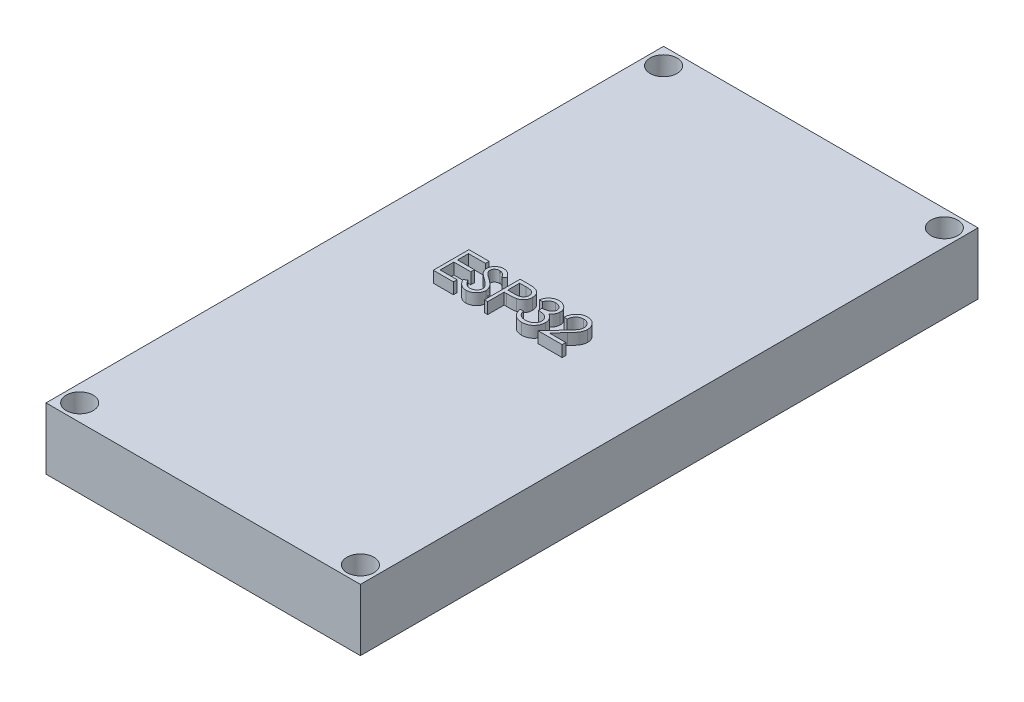
from build123d import *

# Parameters (mm, degrees)
SKETCH1_W           = 28
SKETCH1_H           = 55
SKETCH1_R           = 1.2
BOSS_EXTRUDE1_DEPTH = 5.5
BOSS_EXTRUDE2_DEPTH = 1


with BuildPart() as part:
    # Sketch1 → Boss-Extrude1 (new body)
    with BuildSketch(Plane(origin=(0, 0, 0), x_dir=(1, 0, 0), z_dir=(0, 1, 0))):
        Rectangle(SKETCH1_W, SKETCH1_H)
        with Locations(Location((-12.5, 26, 0), (0, 0, 270))):
            Circle(SKETCH1_R, mode=Mode.SUBTRACT)
        with Locations(Location((-12.5, -26, 0), (0, 0, 270))):
            Circle(SKETCH1_R, mode=Mode.SUBTRACT)
        with Locations(Location((12.5, -26, 0), (0, 0, 270))):
            Circle(SKETCH1_R, mode=Mode.SUBTRACT)
        with Locations(Location((12.5, 26, 0), (0, 0, 270))):
            Circle(SKETCH1_R, mode=Mode.SUBTRACT)
    extrude(amount=BOSS_EXTRUDE1_DEPTH)

    # Sketch2 → Boss-Extrude2 (add)
    # profile 1 of 5: a face of its own
    with BuildSketch(Plane(origin=(0, 5.5, 0), x_dir=(1, 0, 0), z_dir=(0, 1, 0))):
        Polygon((-5.984730254, 2.150902406), (-4.193704613, 2.150902406), (-4.193704613, 1.82526138), (-5.699794357, 1.82526138), (-5.699794357, 0.848338303), (-4.193704613, 0.848338303), (-4.193704613, 0.522697278), (-5.699794357, 0.522697278), (-5.699794357, -0.698456569), (-4.193704613, -0.698456569), (-4.193704613, -1.024097594), (-5.984730254, -1.024097594), align=None)
    # profile 2 of 5: a face of its own
    with BuildSketch(Plane(origin=(0, 5.5, 0), x_dir=(1, 0, 0), z_dir=(0, 1, 0))):
        with BuildLine():
            Line((-3.949473844, -0.411612618), (-3.681074405, -0.250700158))
            add(Edge.make_bspline(
                [(-3.681074405, -0.250700158), (-3.656111433, -0.292487136), (-3.608283341, -0.372549373), (-3.528498894, -0.480733452), (-3.445828324, -0.572683409), (-3.359659429, -0.647864332), (-3.270518176, -0.707054393), (-3.177822642, -0.748966418), (-3.081885199, -0.775106624), (-3.016594661, -0.778281702), (-2.983999085, -0.779866825)],
                knots=[0, 0, 0, 0, 1.272034388, 2.437168799, 3.508375237, 4.49857839, 5.41946034, 6.295179144, 7.148887113, 8, 8, 8, 8], degree=3))
            add(Edge.make_bspline(
                [(-2.983999085, -0.779866825), (-2.956161718, -0.779091515), (-2.900974074, -0.777554461), (-2.819728325, -0.762785448), (-2.740823405, -0.740095874), (-2.665885569, -0.707601171), (-2.595948833, -0.668286974), (-2.534619902, -0.620801513), (-2.481600928, -0.567637312), (-2.438231231, -0.508325904), (-2.404957199, -0.444538204), (-2.379382966, -0.379064306), (-2.365190649, -0.310875676), (-2.363052737, -0.264964756), (-2.361973844, -0.241795912)],
                knots=[0, 0, 0, 0, 1.095163259, 2.171163733, 3.241058638, 4.321873601, 5.38011039, 6.391990106, 7.366004449, 8.327778327, 9.272591725, 10.192022065, 11.087607919, 12, 12, 12, 12], degree=3))
            add(Edge.make_bspline(
                [(-2.361973844, -0.241795912), (-2.363311255, -0.215360998), (-2.366030015, -0.161622681), (-2.389009286, -0.08233871), (-2.425158245, -0.003877593), (-2.458507215, 0.044655698), (-2.475821, 0.069852726)],
                knots=[0, 0, 0, 0, 0.938893495, 1.908633276, 2.914225137, 4, 4, 4, 4], degree=3))
            add(Edge.make_bspline(
                [(-2.475821, 0.069852726), (-2.490036485, 0.088038059), (-2.51988012, 0.126215891), (-2.571185863, 0.183044069), (-2.63138941, 0.241662206), (-2.698430492, 0.304308636), (-2.774751222, 0.368069709), (-2.857961182, 0.435985932), (-2.950184825, 0.505474506), (-3.014863654, 0.552076762), (-3.048236865, 0.576122758)],
                knots=[0, 0, 0, 0, 0.722233717, 1.516239348, 2.393582979, 3.351407094, 4.387010283, 5.505090956, 6.712668013, 8, 8, 8, 8], degree=3))
            add(Edge.make_bspline(
                [(-3.048236865, 0.576122758), (-3.08164149, 0.599915834), (-3.14550859, 0.645406384), (-3.234824589, 0.712919841), (-3.314693495, 0.774645351), (-3.384760317, 0.831163991), (-3.444994237, 0.882483425), (-3.495869903, 0.928110841), (-3.536091308, 0.969280215), (-3.558457442, 0.995987717), (-3.568499285, 1.007978728)],
                knots=[0, 0, 0, 0, 1.452282411, 2.77665338, 3.964542531, 5.026858415, 5.96415736, 6.766646006, 7.446254459, 8, 8, 8, 8], degree=3))
            add(Edge.make_bspline(
                [(-3.568499285, 1.007978728), (-3.582535094, 1.026666811), (-3.610138396, 1.063419435), (-3.646574701, 1.120864128), (-3.677543798, 1.17966809), (-3.701821057, 1.239989339), (-3.722264627, 1.300981024), (-3.736015035, 1.36343894), (-3.744625088, 1.427082829), (-3.745506819, 1.469912219), (-3.745948203, 1.491352125)],
                knots=[0, 0, 0, 0, 1.068054152, 2.10047183, 3.106115577, 4.101338837, 5.06977816, 6.043150881, 7.020423561, 8, 8, 8, 8], degree=3))
            add(Edge.make_bspline(
                [(-3.745948203, 1.491352125), (-3.744764192, 1.524943421), (-3.742421478, 1.591408021), (-3.722609008, 1.688500275), (-3.691337169, 1.781197953), (-3.647526807, 1.868583327), (-3.591050494, 1.948381039), (-3.525694502, 2.021508988), (-3.447851226, 2.082984773), (-3.362441346, 2.136698569), (-3.268954494, 2.178740944), (-3.170991318, 2.210455547), (-3.068396116, 2.228425374), (-2.99890613, 2.231004168), (-2.963646521, 2.232312662)],
                knots=[0, 0, 0, 0, 1.005424448, 1.989358655, 2.955360095, 3.929531133, 4.905563448, 5.876582895, 6.856512386, 7.866279853, 8.892233794, 9.918561126, 10.94386622, 12, 12, 12, 12], degree=3))
            add(Edge.make_bspline(
                [(-2.963646521, 2.232312662), (-2.92623223, 2.231022205), (-2.851827146, 2.228455896), (-2.742381072, 2.206142422), (-2.637006708, 2.169221098), (-2.552240318, 2.127321387), (-2.485898455, 2.085473603), (-2.435304619, 2.047355619), (-2.384035218, 2.003472485), (-2.331676696, 1.953707312), (-2.279116241, 1.897603473), (-2.225573538, 1.835545205), (-2.17092338, 1.767911758), (-2.135766278, 1.719629533), (-2.117743075, 1.694877766)],
                knots=[0, 0, 0, 0, 1.286793592, 2.559021753, 3.825965368, 5.121522368, 5.803751409, 6.523245864, 7.299691795, 8.125521123, 9.008227632, 9.944561021, 10.946284179, 12, 12, 12, 12], degree=3))
            Line((-2.117743075, 1.694877766), (-2.375330214, 1.499620354))
            add(Edge.make_bspline(
                [(-2.375330214, 1.499620354), (-2.390884025, 1.519657952), (-2.420837026, 1.55824568), (-2.466311632, 1.612285374), (-2.509172906, 1.661648895), (-2.551400768, 1.704525118), (-2.590764991, 1.743262053), (-2.628971165, 1.776426975), (-2.66546947, 1.804344837), (-2.711476953, 1.834138638), (-2.769278026, 1.863672037), (-2.841835427, 1.888662987), (-2.917660119, 1.903680793), (-2.969303428, 1.905666427), (-2.995447402, 1.906671637)],
                knots=[0, 0, 0, 0, 1.181633172, 2.275549214, 3.290209073, 4.226197932, 5.078386478, 5.862611352, 6.581680152, 7.217281963, 8.414376989, 9.595101626, 10.782541182, 12, 12, 12, 12], degree=3))
            add(Edge.make_bspline(
                [(-2.995447402, 1.906671637), (-3.028246533, 1.905572452), (-3.091496567, 1.903452777), (-3.181294853, 1.880302505), (-3.262115771, 1.843851817), (-3.331559883, 1.792766087), (-3.389378427, 1.732240615), (-3.431202664, 1.662591225), (-3.456376028, 1.585681474), (-3.459447867, 1.532031543), (-3.461012306, 1.504708495)],
                knots=[0, 0, 0, 0, 1.14458467, 2.207223713, 3.21896685, 4.227309161, 5.202851033, 6.127160689, 7.046193047, 8, 8, 8, 8], degree=3))
            add(Edge.make_bspline(
                [(-3.461012306, 1.504708495), (-3.460655684, 1.487698226), (-3.459941857, 1.453649871), (-3.449986147, 1.40334751), (-3.437196042, 1.353172223), (-3.416928083, 1.303349594), (-3.388946986, 1.253008283), (-3.352203005, 1.201281421), (-3.305926643, 1.147713085), (-3.270478211, 1.112872111), (-3.251762506, 1.094477125)],
                knots=[0, 0, 0, 0, 0.858281714, 1.717966888, 2.583508476, 3.4729293, 4.427298488, 5.488583878, 6.674047936, 8, 8, 8, 8], degree=3))
            add(Edge.make_bspline(
                [(-3.251762506, 1.094477125), (-3.244812547, 1.088274966), (-3.228301035, 1.073540056), (-3.198115016, 1.049417058), (-3.158252621, 1.019660258), (-3.109754767, 0.982841763), (-3.051727231, 0.940132151), (-2.984163634, 0.892077518), (-2.907817101, 0.837117851), (-2.853640791, 0.798693511), (-2.824994678, 0.778376364)],
                knots=[0, 0, 0, 0, 0.420754252, 0.999615792, 1.744751191, 2.668019286, 3.750313428, 4.999500688, 6.413464383, 8, 8, 8, 8], degree=3))
            add(Edge.make_bspline(
                [(-2.824994678, 0.778376364), (-2.790536028, 0.753301702), (-2.723811628, 0.704748095), (-2.628872252, 0.631799585), (-2.542790012, 0.560454824), (-2.465262677, 0.491169423), (-2.395524339, 0.424468938), (-2.334348692, 0.359550911), (-2.281112396, 0.296880427), (-2.22379982, 0.216532447), (-2.165236655, 0.117852464), (-2.114943287, -0.003049938), (-2.083231072, -0.124422315), (-2.079084054, -0.205998802), (-2.077037947, -0.246248035)],
                knots=[0, 0, 0, 0, 1.163667725, 2.253281268, 3.268753668, 4.215851969, 5.092017293, 5.902905408, 6.650798638, 7.335211899, 8.59617414, 9.77448103, 10.901945474, 12, 12, 12, 12], degree=3))
            add(Edge.make_bspline(
                [(-2.077037947, -0.246248035), (-2.077634065, -0.274712695), (-2.078814725, -0.33108925), (-2.092386411, -0.413870641), (-2.112270679, -0.494271501), (-2.14224017, -0.57129801), (-2.178819035, -0.646359331), (-2.225234131, -0.717486498), (-2.279034673, -0.786253731), (-2.340751017, -0.850827326), (-2.408284086, -0.910105661), (-2.479661437, -0.962837024), (-2.554999899, -1.006804718), (-2.633890772, -1.042682982), (-2.716352178, -1.070744101), (-2.802356382, -1.091075775), (-2.892045153, -1.10355417), (-2.953005589, -1.104849354), (-2.983999085, -1.105507851)],
                knots=[0, 0, 0, 0, 0.983748083, 1.948392443, 2.894712957, 3.844097841, 4.80183111, 5.778335162, 6.776009319, 7.81870978, 8.863265674, 9.881300176, 10.883814829, 11.87499822, 12.874611388, 13.892143829, 14.928324115, 16, 16, 16, 16], degree=3))
            add(Edge.make_bspline(
                [(-2.983999085, -1.105507851), (-3.007979717, -1.105044136), (-3.055638971, -1.104122546), (-3.126132572, -1.095975242), (-3.195202057, -1.084448084), (-3.261980727, -1.06614732), (-3.32732895, -1.043943205), (-3.390962513, -1.016603432), (-3.452912255, -0.983839971), (-3.513525348, -0.946379484), (-3.572647635, -0.902784245), (-3.629724581, -0.852008287), (-3.686628913, -0.795452008), (-3.741681051, -0.731579568), (-3.795994547, -0.661422879), (-3.848498532, -0.584325548), (-3.900279805, -0.50070752), (-3.932769551, -0.441865621), (-3.949473844, -0.411612618)],
                knots=[0, 0, 0, 0, 0.915332311, 1.819136955, 2.706846663, 3.586547465, 4.459518054, 5.340707479, 6.227863349, 7.133153174, 8.059268498, 9.028702269, 10.047606654, 11.120612155, 12.245963614, 13.433783089, 14.680604001, 16, 16, 16, 16], degree=3))
        make_face()
    # profile 3 of 5: a face of its own
    with BuildSketch(Plane(origin=(0, 5.5, 0), x_dir=(1, 0, 0), z_dir=(0, 1, 0))):
        with BuildLine():
            Line((-1.425755896, 2.150902406), (-0.803094638, 2.150902406))
            add(Edge.make_bspline(
                [(-0.803094638, 2.150902406), (-0.760267601, 2.150855328), (-0.678209098, 2.150765126), (-0.560539011, 2.148030321), (-0.453668755, 2.144377536), (-0.357828767, 2.139313962), (-0.272724163, 2.133329912), (-0.198740042, 2.12493699), (-0.135294873, 2.116173722), (-0.097279736, 2.107264304), (-0.079942594, 2.103201084)],
                knots=[0, 0, 0, 0, 1.415646017, 2.712440637, 3.8905458, 4.950247383, 5.884950622, 6.709939814, 7.411656543, 8, 8, 8, 8], degree=3))
            add(Edge.make_bspline(
                [(-0.079942594, 2.103201084), (-0.057995603, 2.097194029), (-0.014618774, 2.085321469), (0.047884316, 2.061541877), (0.107351018, 2.033345913), (0.163985361, 2.001211339), (0.217091393, 1.963759434), (0.267461444, 1.922508367), (0.314650998, 1.876505729), (0.358394689, 1.826267487), (0.398567327, 1.772637011), (0.433156396, 1.714813702), (0.462118952, 1.653770877), (0.486959491, 1.589550994), (0.504837875, 1.521614772), (0.518306134, 1.450434255), (0.526854711, 1.376017072), (0.527673463, 1.325162763), (0.528090258, 1.299274802)],
                knots=[0, 0, 0, 0, 0.999701418, 1.975846123, 2.934577507, 3.890451536, 4.834027766, 5.787354733, 6.749476667, 7.726910423, 8.712836071, 9.690891519, 10.682875813, 11.679750201, 12.712814741, 13.765529915, 14.8625177, 16, 16, 16, 16], degree=3))
            add(Edge.make_bspline(
                [(0.528090258, 1.299274802), (0.527707966, 1.273169247), (0.526959985, 1.222091966), (0.51798264, 1.14736808), (0.505890252, 1.075959254), (0.487296498, 1.008023824), (0.462943637, 0.943965232), (0.434375846, 0.882804543), (0.399919358, 0.82558227), (0.360327262, 0.77209067), (0.31628403, 0.722279535), (0.267976008, 0.676509829), (0.215598221, 0.635049465), (0.15931713, 0.597805496), (0.098584053, 0.565641585), (0.034320099, 0.536833173), (-0.034033312, 0.512638711), (-0.081334021, 0.499911441), (-0.105383299, 0.493440467)],
                knots=[0, 0, 0, 0, 1.121902311, 2.195077645, 3.232258892, 4.234102512, 5.217864754, 6.176164875, 7.132989551, 8.084763148, 9.034132444, 9.988522005, 10.94243251, 11.903244335, 12.886203696, 13.894208494, 14.929344452, 16, 16, 16, 16], degree=3))
            add(Edge.make_bspline(
                [(-0.105383299, 0.493440467), (-0.125274524, 0.489210477), (-0.168867299, 0.479940208), (-0.240661054, 0.469591108), (-0.324250082, 0.460757713), (-0.419520293, 0.454134538), (-0.526386171, 0.448464561), (-0.644905526, 0.44395779), (-0.775311011, 0.441481422), (-0.866271353, 0.441353703), (-0.913761705, 0.441287021)],
                knots=[0, 0, 0, 0, 0.601384939, 1.31797006, 2.144135048, 3.087295005, 4.142315834, 5.309527816, 6.595305764, 8, 8, 8, 8], degree=3))
            Line((-0.913761705, 0.441287021), (-1.140819998, 0.441287021))
            Line((-1.140819998, 0.441287021), (-1.140819998, -1.024097594))
            Line((-1.140819998, -1.024097594), (-1.425755896, -1.024097594))
            Line((-1.425755896, -1.024097594), (-1.425755896, 2.150902406))
        make_face()
        with BuildLine():
            Line((-1.140819998, 1.82526138), (-1.140819998, 0.766928047))
            Line((-1.140819998, 0.766928047), (-0.584940591, 0.759931853))
            add(Edge.make_bspline(
                [(-0.584940591, 0.759931853), (-0.557798944, 0.759917825), (-0.505402554, 0.759890745), (-0.42971398, 0.763505912), (-0.359492698, 0.767679252), (-0.294954405, 0.773789697), (-0.236070007, 0.782426838), (-0.18274132, 0.791146057), (-0.135381856, 0.803760208), (-0.079956152, 0.820744706), (-0.01819483, 0.84971215), (0.048995018, 0.891758122), (0.105936907, 0.945352764), (0.155211362, 1.005612297), (0.194314551, 1.072649365), (0.222940344, 1.144376186), (0.239759823, 1.220057164), (0.242015156, 1.271844261), (0.243154361, 1.298002766)],
                knots=[0, 0, 0, 0, 1.160613943, 2.240541288, 3.23993089, 4.169200891, 5.011653406, 5.7853311, 6.478053781, 7.106038997, 8.262395093, 9.384106736, 10.481365981, 11.59014053, 12.70357646, 13.786202915, 14.881775077, 16, 16, 16, 16], degree=3))
            add(Edge.make_bspline(
                [(0.243154361, 1.298002766), (0.24200896, 1.323528418), (0.239732045, 1.374270254), (0.222808512, 1.448636701), (0.194370206, 1.519607661), (0.154948867, 1.585804674), (0.107105127, 1.645847375), (0.051497866, 1.698005483), (-0.011742021, 1.739935171), (-0.07056863, 1.766998219), (-0.122821135, 1.783522076), (-0.16820727, 1.795083467), (-0.219452382, 1.804314196), (-0.276573153, 1.811788602), (-0.339126853, 1.818187099), (-0.407650895, 1.822528664), (-0.4818857, 1.825069985), (-0.533421004, 1.825196037), (-0.560135904, 1.82526138)],
                knots=[0, 0, 0, 0, 1.120700087, 2.227813068, 3.331159281, 4.466773991, 5.599788987, 6.693661531, 7.80175334, 8.91857717, 9.525282508, 10.207424825, 10.974604443, 11.810962634, 12.737642355, 13.736264703, 14.826523623, 16, 16, 16, 16], degree=3))
            Line((-0.560135904, 1.82526138), (-1.140819998, 1.82526138))
        make_face(mode=Mode.SUBTRACT)
    # profile 4 of 5: a face of its own
    with BuildSketch(Plane(origin=(0, 5.5, 0), x_dir=(1, 0, 0), z_dir=(0, 1, 0))):
        with BuildLine():
            Line((1.301487694, 1.418210098), (1.016551797, 1.418210098))
            add(Edge.make_bspline(
                [(1.016551797, 1.418210098), (1.024271175, 1.450170994), (1.039361928, 1.512651932), (1.070837584, 1.601921376), (1.105126908, 1.686397713), (1.14630131, 1.764499151), (1.191212823, 1.837795299), (1.242668434, 1.904623719), (1.298294183, 1.966684052), (1.359821101, 2.021759632), (1.424344958, 2.071632286), (1.492774935, 2.114154659), (1.563734274, 2.150734427), (1.637714616, 2.180869923), (1.714936215, 2.203571648), (1.794700945, 2.220042464), (1.877217834, 2.230738689), (1.93323172, 2.231782596), (1.961673992, 2.232312662)],
                knots=[0, 0, 0, 0, 1.162005537, 2.271625781, 3.343758855, 4.383309926, 5.390229558, 6.379919256, 7.361854164, 8.333198761, 9.295911338, 10.242430842, 11.177959212, 12.116337295, 13.062827104, 14.020064771, 14.994644689, 16, 16, 16, 16], degree=3))
            add(Edge.make_bspline(
                [(1.961673992, 2.232312662), (2.003114765, 2.231061503), (2.085092368, 2.228586477), (2.205527418, 2.205985524), (2.321666032, 2.170221297), (2.432236993, 2.120805844), (2.534942285, 2.059857353), (2.626324398, 1.987317913), (2.70514469, 1.904587118), (2.771270304, 1.813208292), (2.823045481, 1.715549366), (2.861223834, 1.615037794), (2.884466359, 1.511912006), (2.887478579, 1.442282189), (2.888987694, 1.407397798)],
                knots=[0, 0, 0, 0, 1.083050992, 2.142477498, 3.193116406, 4.255571735, 5.30263384, 6.308962982, 7.297363603, 8.282367274, 9.249857812, 10.179914175, 11.08814088, 12, 12, 12, 12], degree=3))
            add(Edge.make_bspline(
                [(2.888987694, 1.407397798), (2.887932151, 1.373827349), (2.885866616, 1.308135189), (2.868328184, 1.212230688), (2.838813145, 1.121841522), (2.797928432, 1.036587182), (2.745004311, 0.95700822), (2.680894079, 0.88292559), (2.605145236, 0.814010711), (2.547742199, 0.774532332), (2.518189417, 0.754207694)],
                knots=[0, 0, 0, 0, 1.024540389, 2.004866551, 2.965041327, 3.920577974, 4.882998113, 5.874504559, 6.905732034, 8, 8, 8, 8], degree=3))
            add(Edge.make_bspline(
                [(2.518189417, 0.754207694), (2.551963937, 0.737898924), (2.61888103, 0.705586534), (2.710094725, 0.642217383), (2.792896798, 0.569050553), (2.839073743, 0.511952575), (2.862274954, 0.483264185)],
                knots=[0, 0, 0, 0, 1.015518401, 2.012035669, 3.001164323, 4, 4, 4, 4], degree=3))
            add(Edge.make_bspline(
                [(2.862274954, 0.483264185), (2.877552457, 0.46234751), (2.907857284, 0.420856686), (2.945263804, 0.354148642), (2.979199215, 0.28670122), (3.005642628, 0.216706616), (3.02612035, 0.144976096), (3.040758037, 0.071386494), (3.049851365, -0.004122284), (3.051153615, -0.055205748), (3.051808207, -0.080883452)],
                knots=[0, 0, 0, 0, 1.025084078, 2.033381695, 3.024893161, 4.013698104, 4.991890475, 5.976764909, 6.982997093, 8, 8, 8, 8], degree=3))
            add(Edge.make_bspline(
                [(3.051808207, -0.080883452), (3.050180327, -0.12534227), (3.046932228, -0.214050683), (3.01789996, -0.345109895), (2.972893663, -0.473221601), (2.908979157, -0.595753776), (2.83108506, -0.710398836), (2.738413773, -0.812975202), (2.632018245, -0.901148222), (2.513358835, -0.9748175), (2.384801154, -1.03370733), (2.247300439, -1.074580867), (2.10283789, -1.101201881), (2.00377127, -1.104056541), (1.953405763, -1.105507851)],
                knots=[0, 0, 0, 0, 0.955779014, 1.907060117, 2.875433937, 3.871313158, 4.872415639, 5.851225146, 6.836215519, 7.83643374, 8.849228613, 9.86973379, 10.916971861, 12, 12, 12, 12], degree=3))
            add(Edge.make_bspline(
                [(1.953405763, -1.105507851), (1.919461112, -1.104720257), (1.852669358, -1.103170536), (1.754477042, -1.092576376), (1.6607495, -1.073227014), (1.571360008, -1.047189016), (1.486229154, -1.014176507), (1.405616715, -0.973065974), (1.32902674, -0.924704826), (1.257181978, -0.868522214), (1.190090991, -0.805674141), (1.129536734, -0.735044896), (1.074509636, -0.657940109), (1.0264831, -0.573464193), (0.983269578, -0.482708853), (0.947726854, -0.384512001), (0.916443516, -0.279751495), (0.901898874, -0.206746688), (0.894436412, -0.169289902)],
                knots=[0, 0, 0, 0, 1.048658725, 2.063410685, 3.046034179, 4.001477787, 4.936774919, 5.862367409, 6.792675028, 7.730719943, 8.675894397, 9.627829632, 10.600096036, 11.597688215, 12.626045268, 13.701542398, 14.82072376, 16, 16, 16, 16], degree=3))
            Line((0.894436412, -0.169289902), (1.17937231, -0.169289902))
            add(Edge.make_bspline(
                [(1.17937231, -0.169289902), (1.186795724, -0.193736507), (1.20123491, -0.241287277), (1.225813309, -0.309722411), (1.253815241, -0.372458645), (1.283854877, -0.429956192), (1.315403895, -0.4827813), (1.350705292, -0.529537138), (1.387144445, -0.572277357), (1.414612144, -0.596357112), (1.428055202, -0.608142065)],
                knots=[0, 0, 0, 0, 1.198163088, 2.33053128, 3.407730985, 4.417276592, 5.372219308, 6.28897303, 7.162600585, 8, 8, 8, 8], degree=3))
            add(Edge.make_bspline(
                [(1.428055202, -0.608142065), (1.445832097, -0.621847483), (1.481331012, -0.649216011), (1.539177908, -0.684142489), (1.60001534, -0.714405705), (1.665161509, -0.737523057), (1.733210622, -0.757097078), (1.805262589, -0.769906406), (1.880681736, -0.778694961), (1.932178207, -0.779470506), (1.958493904, -0.779866825)],
                knots=[0, 0, 0, 0, 0.946170439, 1.889420265, 2.845303464, 3.807233317, 4.801018734, 5.828864929, 6.890507805, 8, 8, 8, 8], degree=3))
            add(Edge.make_bspline(
                [(1.958493904, -0.779866825), (1.98820601, -0.779308111), (2.046305468, -0.778215594), (2.131082377, -0.768168346), (2.211734133, -0.753535756), (2.287365287, -0.730936122), (2.358966533, -0.703013492), (2.425534172, -0.667953867), (2.487942068, -0.626819727), (2.545390886, -0.580066347), (2.597048596, -0.528883991), (2.642532298, -0.475350705), (2.681198955, -0.419692203), (2.712389772, -0.361600479), (2.7370192, -0.301316093), (2.753786103, -0.238669869), (2.765444264, -0.174174492), (2.76639369, -0.130333213), (2.76687231, -0.10823221)],
                knots=[0, 0, 0, 0, 1.217147791, 2.380027433, 3.494444702, 4.572153297, 5.609568379, 6.639424714, 7.649109417, 8.668170816, 9.669597737, 10.625200337, 11.543417969, 12.441394052, 13.322311151, 14.205496177, 15.095365482, 16, 16, 16, 16], degree=3))
            add(Edge.make_bspline(
                [(2.76687231, -0.10823221), (2.765484108, -0.078649067), (2.762714611, -0.019629982), (2.741570399, 0.067199532), (2.706791573, 0.150859342), (2.658102937, 0.229922094), (2.598834098, 0.303197376), (2.529560218, 0.368576507), (2.449706039, 0.422524375), (2.376209444, 0.459797656), (2.311108195, 0.485231289), (2.255395668, 0.502172149), (2.193023606, 0.516517394), (2.124746275, 0.529863526), (2.050049214, 0.541222178), (1.969013746, 0.550694396), (1.881623448, 0.558273612), (1.821125033, 0.561658248), (1.789949233, 0.563402406)],
                knots=[0, 0, 0, 0, 1.07054697, 2.135767047, 3.216561865, 4.33974944, 5.486079747, 6.621378074, 7.775625952, 8.963672916, 9.598146892, 10.304877434, 11.070270905, 11.915000392, 12.823868403, 13.805723172, 14.86925407, 16, 16, 16, 16], degree=3))
            Line((1.789949233, 0.563402406), (1.789949233, 0.889043431))
            add(Edge.make_bspline(
                [(1.789949233, 0.889043431), (1.829229576, 0.889710003), (1.906170119, 0.891015654), (2.018559952, 0.906807206), (2.126032171, 0.928651776), (2.226205002, 0.962111915), (2.317507763, 1.000974184), (2.396719116, 1.04619726), (2.462729314, 1.096466354), (2.515217572, 1.152557364), (2.554704801, 1.212714585), (2.583576253, 1.275413268), (2.600630834, 1.341202952), (2.602907461, 1.386101686), (2.604051797, 1.408669834)],
                knots=[0, 0, 0, 0, 1.321986639, 2.589447074, 3.816329219, 5.01088745, 6.139805852, 7.153945165, 8.075214402, 8.924034688, 9.728124013, 10.488707548, 11.240355623, 12, 12, 12, 12], degree=3))
            add(Edge.make_bspline(
                [(2.604051797, 1.408669834), (2.603675867, 1.42525036), (2.602927972, 1.45823653), (2.593496156, 1.506428556), (2.579322919, 1.553147271), (2.559837736, 1.598193999), (2.533757198, 1.641256319), (2.502546053, 1.682701362), (2.465382134, 1.722292505), (2.422795907, 1.759195366), (2.377065198, 1.794364602), (2.326945759, 1.824221973), (2.273948773, 1.849753565), (2.218015565, 1.870807899), (2.158964619, 1.886645968), (2.097073385, 1.898017767), (2.032223843, 1.905127639), (1.987980915, 1.906151274), (1.965490098, 1.906671637)],
                knots=[0, 0, 0, 0, 0.884392785, 1.759457502, 2.611959086, 3.489218968, 4.37281399, 5.2945488, 6.255912374, 7.266815255, 8.301784654, 9.332968512, 10.37626691, 11.440494194, 12.520033166, 13.637162961, 14.798855837, 16, 16, 16, 16], degree=3))
            add(Edge.make_bspline(
                [(1.965490098, 1.906671637), (1.929338942, 1.905409472), (1.858727326, 1.902944172), (1.756932366, 1.881351439), (1.662299827, 1.846899892), (1.589965466, 1.805776367), (1.536550559, 1.76518133), (1.498380765, 1.729728023), (1.460897159, 1.690328247), (1.426565724, 1.644555292), (1.391845759, 1.59550899), (1.360236764, 1.540696079), (1.329521186, 1.481546378), (1.311013159, 1.439731052), (1.301487694, 1.418210098)],
                knots=[0, 0, 0, 0, 1.472543308, 2.876219568, 4.221790263, 5.565193594, 6.249813518, 6.953379497, 7.687249741, 8.463570142, 9.283606569, 10.136032583, 11.040678096, 12, 12, 12, 12], degree=3))
        make_face()
    # profile 5 of 5: a face of its own
    with BuildSketch(Plane(origin=(0, 5.5, 0), x_dir=(1, 0, 0), z_dir=(0, 1, 0))):
        with BuildLine():
            Line((3.743795387, 1.173979329), (3.458859489, 1.173979329))
            add(Edge.make_bspline(
                [(3.458859489, 1.173979329), (3.460716549, 1.211780777), (3.464363766, 1.286021815), (3.481443714, 1.394265645), (3.505882939, 1.497729641), (3.540437329, 1.595583063), (3.583350881, 1.688691123), (3.63481312, 1.776683995), (3.695767542, 1.859226002), (3.764897936, 1.935551952), (3.839980916, 2.005572106), (3.920994161, 2.066037933), (4.006125007, 2.117126107), (4.095115176, 2.159835519), (4.188968687, 2.191893808), (4.286833851, 2.215680581), (4.389140639, 2.22999198), (4.458845516, 2.2315303), (4.494296188, 2.232312662)],
                knots=[0, 0, 0, 0, 1.10065271, 2.161652631, 3.183658789, 4.190468796, 5.17591951, 6.163126047, 7.15150782, 8.156236427, 9.156009102, 10.134482811, 11.092018607, 12.041330605, 13.001268258, 13.972401359, 14.968799086, 16, 16, 16, 16], degree=3))
            add(Edge.make_bspline(
                [(4.494296188, 2.232312662), (4.529110584, 2.231497634), (4.597519628, 2.229896132), (4.697361598, 2.216142913), (4.792409572, 2.194602269), (4.88247776, 2.164380427), (4.966847548, 2.123754554), (5.046152738, 2.074952501), (5.121337473, 2.018510225), (5.189016484, 1.952058551), (5.251163099, 1.881117817), (5.304777288, 1.805382362), (5.350690657, 1.727160081), (5.38896091, 1.645854498), (5.417133264, 1.560700065), (5.438522067, 1.472936531), (5.450611936, 1.381655453), (5.452467427, 1.319873077), (5.453410771, 1.288462502)],
                knots=[0, 0, 0, 0, 1.111607364, 2.184268762, 3.212621178, 4.221274766, 5.211760367, 6.196651075, 7.1921475, 8.207485113, 9.220403448, 10.201281604, 11.166441695, 12.114753415, 13.065576456, 14.026450734, 14.996634279, 16, 16, 16, 16], degree=3))
            add(Edge.make_bspline(
                [(5.453410771, 1.288462502), (5.451880743, 1.244239461), (5.448847537, 1.15656943), (5.422671293, 1.027569763), (5.382228962, 0.902470173), (5.333177, 0.801796319), (5.283628342, 0.721081566), (5.239922384, 0.65402952), (5.187623464, 0.582522699), (5.127210097, 0.505840907), (5.059593658, 0.423749586), (4.984287495, 0.336215048), (4.900716333, 0.244166986), (4.842062125, 0.181296713), (4.811668984, 0.148718912)],
                knots=[0, 0, 0, 0, 1.184203166, 2.347625244, 3.513805382, 4.700623107, 5.337941753, 6.051866363, 6.845199593, 7.711357327, 8.668078039, 9.695487809, 10.805859518, 12, 12, 12, 12], degree=3))
            Line((4.811668984, 0.148718912), (4.017282967, -0.698456569))
            Line((4.017282967, -0.698456569), (5.494115899, -0.698456569))
            Line((5.494115899, -0.698456569), (5.494115899, -1.024097594))
            Line((5.494115899, -1.024097594), (3.336744104, -1.024097594))
            Line((3.336744104, -1.024097594), (4.568074233, 0.289914826))
            add(Edge.make_bspline(
                [(4.568074233, 0.289914826), (4.598053387, 0.321209718), (4.655637207, 0.381320802), (4.737082831, 0.469080487), (4.810233913, 0.550496142), (4.875563976, 0.625413939), (4.931655799, 0.694929719), (4.981432752, 0.756792057), (5.021315824, 0.813719308), (5.064600505, 0.879705436), (5.106523188, 0.960270896), (5.142547968, 1.058726457), (5.164514295, 1.160079036), (5.167149395, 1.228570169), (5.168474874, 1.263021797)],
                knots=[0, 0, 0, 0, 1.329631726, 2.553950428, 3.673215718, 4.687767853, 5.603093632, 6.413772471, 7.123043292, 7.734684054, 8.834405432, 9.900288307, 10.943827018, 12, 12, 12, 12], degree=3))
            add(Edge.make_bspline(
                [(5.168474874, 1.263021797), (5.167898165, 1.284685637), (5.166761582, 1.327380905), (5.15673067, 1.389978987), (5.141571854, 1.450362782), (5.119850084, 1.508718029), (5.091178256, 1.564458014), (5.056277404, 1.617650585), (5.016009275, 1.669075575), (4.969426338, 1.71729321), (4.918253031, 1.761454017), (4.864192533, 1.800573724), (4.806997081, 1.833266345), (4.746907827, 1.860066518), (4.684092295, 1.881089899), (4.61842899, 1.895657325), (4.550099347, 1.904803578), (4.503441818, 1.906041077), (4.479667782, 1.906671637)],
                knots=[0, 0, 0, 0, 0.991446411, 1.95395049, 2.89581595, 3.838931463, 4.798493298, 5.75982156, 6.748411868, 7.785213223, 8.824556874, 9.840280684, 10.836137867, 11.835679398, 12.848801643, 13.863922112, 14.911575587, 16, 16, 16, 16], degree=3))
            add(Edge.make_bspline(
                [(4.479667782, 1.906671637), (4.454838527, 1.906023), (4.406077969, 1.904749185), (4.334487132, 1.895838626), (4.266192177, 1.880466328), (4.201021307, 1.859441773), (4.138864255, 1.832718661), (4.0800233, 1.799434007), (4.024630537, 1.759716124), (3.972581833, 1.714685048), (3.924626652, 1.664549438), (3.882492701, 1.6086604), (3.845677202, 1.548038388), (3.813555969, 1.482846974), (3.78747045, 1.412494616), (3.767537663, 1.337231055), (3.75176531, 1.257383088), (3.746496152, 1.202242332), (3.743795387, 1.173979329)],
                knots=[0, 0, 0, 0, 1.031018746, 2.02475058, 2.990194455, 3.934040569, 4.864654155, 5.795059489, 6.735614925, 7.690564532, 8.649604399, 9.611025574, 10.590972636, 11.591080095, 12.624614302, 13.701020113, 14.821632451, 16, 16, 16, 16], degree=3))
        make_face()
    extrude(amount=BOSS_EXTRUDE2_DEPTH)


solid = part.part
